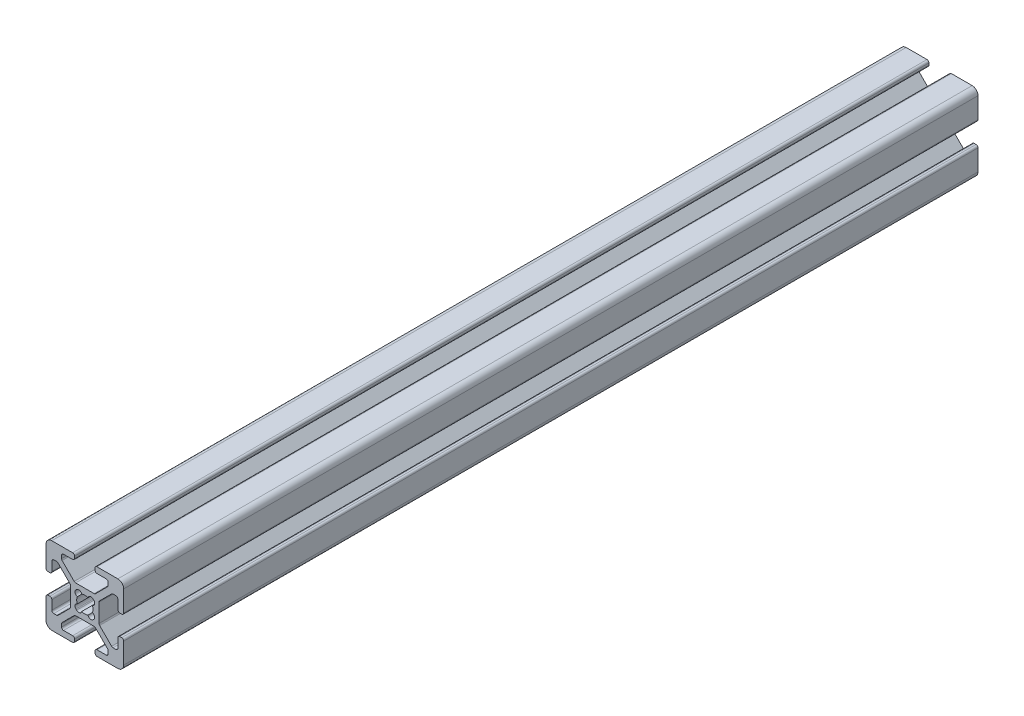
from build123d import *

# Parameters (mm, degrees)
EXTRUDE1_DEPTH = 220


with BuildPart() as part:
    # Sketch1 → Extrude1 (new body)
    with BuildSketch(Plane.XY):
        with BuildLine():
            Line((-5.032287798, -0.341059771), (-5.516287798, -0.341059771))
            ThreePointArc((-5.516287798, -0.341059771), (-5.875498042, -0.192270016), (-6.024287798, 0.166940229))
            Line((-6.024287798, 0.166940229), (-6.024287798, 2.515940229))
            ThreePointArc((-6.024287798, 2.515940229), (-6.173077553, 2.875150474), (-6.532287798, 3.023940229))
            Line((-6.532287798, 3.023940229), (-7.258207136, 3.023940229))
            ThreePointArc((-7.258207136, 3.023940229), (-7.45261032, 2.985271032), (-7.617417381, 2.875150474))
            Line((-7.617417381, 2.875150474), (-10.720498042, -0.227930187))
            ThreePointArc((-10.720498042, -0.227930187), (-10.8306186, -0.392737249), (-10.869287798, -0.587140432))
            Line((-10.869287798, -0.587140432), (-10.869287798, -5.354979109))
            ThreePointArc((-10.869287798, -5.354979109), (-10.8306186, -5.549382293), (-10.720498042, -5.714189354))
            Line((-10.720498042, -5.714189354), (-7.617417381, -8.817270016))
            ThreePointArc((-7.617417381, -8.817270016), (-7.45261032, -8.927390573), (-7.258207136, -8.966059771))
            Line((-7.258207136, -8.966059771), (-6.532287798, -8.966059771))
            ThreePointArc((-6.532287798, -8.966059771), (-6.173077553, -8.817270016), (-6.024287798, -8.458059771))
            Line((-6.024287798, -8.458059771), (-6.024287798, -6.109059771))
            ThreePointArc((-6.024287798, -6.109059771), (-5.875498042, -5.749849526), (-5.516287798, -5.601059771))
            Line((-5.516287798, -5.601059771), (-5.032287798, -5.601059771))
            ThreePointArc((-5.032287798, -5.601059771), (-4.673077553, -5.749849526), (-4.524287798, -6.109059771))
            Line((-4.524287798, -6.109059771), (-4.524287798, -11.471059771))
            ThreePointArc((-4.524287798, -11.471059771), (-4.963627626, -12.531719943), (-6.024287798, -12.971059771))
            Line((-6.024287798, -12.971059771), (-11.386287798, -12.971059771))
            ThreePointArc((-11.386287798, -12.971059771), (-11.745498042, -12.822270016), (-11.894287798, -12.463059771))
            Line((-11.894287798, -12.463059771), (-11.894287798, -11.979059771))
            ThreePointArc((-11.894287798, -11.979059771), (-11.745498042, -11.619849526), (-11.386287798, -11.471059771))
            Line((-11.386287798, -11.471059771), (-9.037287798, -11.471059771))
            ThreePointArc((-9.037287798, -11.471059771), (-8.678077553, -11.322270016), (-8.529287798, -10.963059771))
            Line((-8.529287798, -10.963059771), (-8.529287798, -10.237140432))
            ThreePointArc((-8.529287798, -10.237140432), (-8.567956995, -10.042737249), (-8.678077553, -9.877930187))
            Line((-8.678077553, -9.877930187), (-11.781158214, -6.774849526))
            ThreePointArc((-11.781158214, -6.774849526), (-11.945965275, -6.664728968), (-12.140368459, -6.626059771))
            Line((-12.140368459, -6.626059771), (-16.908207136, -6.626059771))
            ThreePointArc((-16.908207136, -6.626059771), (-17.10261032, -6.664728968), (-17.267417381, -6.774849526))
            Line((-17.267417381, -6.774849526), (-20.370498042, -9.877930187))
            ThreePointArc((-20.370498042, -9.877930187), (-20.4806186, -10.042737249), (-20.519287798, -10.237140432))
            Line((-20.519287798, -10.237140432), (-20.519287798, -10.963059771))
            ThreePointArc((-20.519287798, -10.963059771), (-20.370498042, -11.322270016), (-20.011287798, -11.471059771))
            Line((-20.011287798, -11.471059771), (-17.662287798, -11.471059771))
            ThreePointArc((-17.662287798, -11.471059771), (-17.303077553, -11.619849526), (-17.154287798, -11.979059771))
            Line((-17.154287798, -11.979059771), (-17.154287798, -12.463059771))
            ThreePointArc((-17.154287798, -12.463059771), (-17.303077553, -12.822270016), (-17.662287798, -12.971059771))
            Line((-17.662287798, -12.971059771), (-23.024287798, -12.971059771))
            ThreePointArc((-23.024287798, -12.971059771), (-24.084947969, -12.531719943), (-24.524287798, -11.471059771))
            Line((-24.524287798, -11.471059771), (-24.524287798, -6.109059771))
            ThreePointArc((-24.524287798, -6.109059771), (-24.375498042, -5.749849526), (-24.016287798, -5.601059771))
            Line((-24.016287798, -5.601059771), (-23.532287798, -5.601059771))
            ThreePointArc((-23.532287798, -5.601059771), (-23.173077553, -5.749849526), (-23.024287798, -6.109059771))
            Line((-23.024287798, -6.109059771), (-23.024287798, -8.458059771))
            ThreePointArc((-23.024287798, -8.458059771), (-22.875498042, -8.817270016), (-22.516287798, -8.966059771))
            Line((-22.516287798, -8.966059771), (-21.790368459, -8.966059771))
            ThreePointArc((-21.790368459, -8.966059771), (-21.595965275, -8.927390573), (-21.431158214, -8.817270016))
            Line((-21.431158214, -8.817270016), (-18.328077553, -5.714189354))
            ThreePointArc((-18.328077553, -5.714189354), (-18.217956995, -5.549382293), (-18.179287798, -5.354979109))
            Line((-18.179287798, -5.354979109), (-18.179287798, -0.587140432))
            ThreePointArc((-18.179287798, -0.587140432), (-18.217956995, -0.392737249), (-18.328077553, -0.227930187))
            Line((-18.328077553, -0.227930187), (-21.431158214, 2.875150474))
            ThreePointArc((-21.431158214, 2.875150474), (-21.595965275, 2.985271032), (-21.790368459, 3.023940229))
            Line((-21.790368459, 3.023940229), (-22.516287798, 3.023940229))
            ThreePointArc((-22.516287798, 3.023940229), (-22.875498042, 2.875150474), (-23.024287798, 2.515940229))
            Line((-23.024287798, 2.515940229), (-23.024287798, 0.166940229))
            ThreePointArc((-23.024287798, 0.166940229), (-23.173077553, -0.192270016), (-23.532287798, -0.341059771))
            Line((-23.532287798, -0.341059771), (-24.016287798, -0.341059771))
            ThreePointArc((-24.016287798, -0.341059771), (-24.375498042, -0.192270016), (-24.524287798, 0.166940229))
            Line((-24.524287798, 0.166940229), (-24.524287798, 5.528940229))
            ThreePointArc((-24.524287798, 5.528940229), (-24.084947969, 6.589600401), (-23.024287798, 7.028940229))
            Line((-23.024287798, 7.028940229), (-17.662287798, 7.028940229))
            ThreePointArc((-17.662287798, 7.028940229), (-17.303077553, 6.880150474), (-17.154287798, 6.520940229))
            Line((-17.154287798, 6.520940229), (-17.154287798, 6.036940229))
            ThreePointArc((-17.154287798, 6.036940229), (-17.303077553, 5.677729984), (-17.662287798, 5.528940229))
            Line((-17.662287798, 5.528940229), (-20.011287798, 5.528940229))
            ThreePointArc((-20.011287798, 5.528940229), (-20.370498042, 5.380150474), (-20.519287798, 5.020940229))
            Line((-20.519287798, 5.020940229), (-20.519287798, 4.295020891))
            ThreePointArc((-20.519287798, 4.295020891), (-20.4806186, 4.100617707), (-20.370498042, 3.935810646))
            Line((-20.370498042, 3.935810646), (-17.267417381, 0.832729984))
            ThreePointArc((-17.267417381, 0.832729984), (-17.10261032, 0.722609427), (-16.908207136, 0.683940229))
            Line((-16.908207136, 0.683940229), (-12.140368459, 0.683940229))
            ThreePointArc((-12.140368459, 0.683940229), (-11.945965275, 0.722609427), (-11.781158214, 0.832729984))
            Line((-11.781158214, 0.832729984), (-8.678077553, 3.935810646))
            ThreePointArc((-8.678077553, 3.935810646), (-8.567956995, 4.100617707), (-8.529287798, 4.295020891))
            Line((-8.529287798, 4.295020891), (-8.529287798, 5.020940229))
            ThreePointArc((-8.529287798, 5.020940229), (-8.678077553, 5.380150474), (-9.037287798, 5.528940229))
            Line((-9.037287798, 5.528940229), (-11.386287798, 5.528940229))
            ThreePointArc((-11.386287798, 5.528940229), (-11.745498042, 5.677729984), (-11.894287798, 6.036940229))
            Line((-11.894287798, 6.036940229), (-11.894287798, 6.520940229))
            ThreePointArc((-11.894287798, 6.520940229), (-11.745498042, 6.880150474), (-11.386287798, 7.028940229))
            Line((-11.386287798, 7.028940229), (-6.024287798, 7.028940229))
            ThreePointArc((-6.024287798, 7.028940229), (-4.963627626, 6.589600401), (-4.524287798, 5.528940229))
            Line((-4.524287798, 5.528940229), (-4.524287798, 0.166940229))
            ThreePointArc((-4.524287798, 0.166940229), (-4.673077553, -0.192270016), (-5.032287798, -0.341059771))
        make_face()
        with BuildLine():
            Line((-12.399386954, -5.275565737), (-12.219781831, -5.095960615))
            ThreePointArc((-12.219781831, -5.095960615), (-12.018349781, -4.327527582), (-12.589154291, -3.775036489))
            ThreePointArc((-12.589154291, -3.775036489), (-12.428787798, -2.971059771), (-12.589154291, -2.167083053))
            ThreePointArc((-12.589154291, -2.167083053), (-12.018349781, -1.61459196), (-12.219781831, -0.846158927))
            Line((-12.219781831, -0.846158927), (-12.399386954, -0.666553805))
            ThreePointArc((-12.399386954, -0.666553805), (-13.167819987, -0.465121754), (-13.72031108, -1.035926265))
            ThreePointArc((-13.72031108, -1.035926265), (-14.524287798, -0.875559771), (-15.328264516, -1.035926265))
            ThreePointArc((-15.328264516, -1.035926265), (-15.880755608, -0.465121754), (-16.649188641, -0.666553805))
            Line((-16.649188641, -0.666553805), (-16.828793764, -0.846158927))
            ThreePointArc((-16.828793764, -0.846158927), (-17.030225814, -1.61459196), (-16.459421304, -2.167083053))
            ThreePointArc((-16.459421304, -2.167083053), (-16.619787798, -2.971059771), (-16.459421304, -3.775036489))
            ThreePointArc((-16.459421304, -3.775036489), (-17.030225814, -4.327527582), (-16.828793764, -5.095960615))
            Line((-16.828793764, -5.095960615), (-16.649188641, -5.275565737))
            ThreePointArc((-16.649188641, -5.275565737), (-15.880755608, -5.476997788), (-15.328264516, -4.906193277))
            ThreePointArc((-15.328264516, -4.906193277), (-14.524287798, -5.066559771), (-13.72031108, -4.906193277))
            ThreePointArc((-13.72031108, -4.906193277), (-13.167819987, -5.476997788), (-12.399386954, -5.275565737))
        make_face(mode=Mode.SUBTRACT)
    extrude(amount=EXTRUDE1_DEPTH)


solid = part.part
